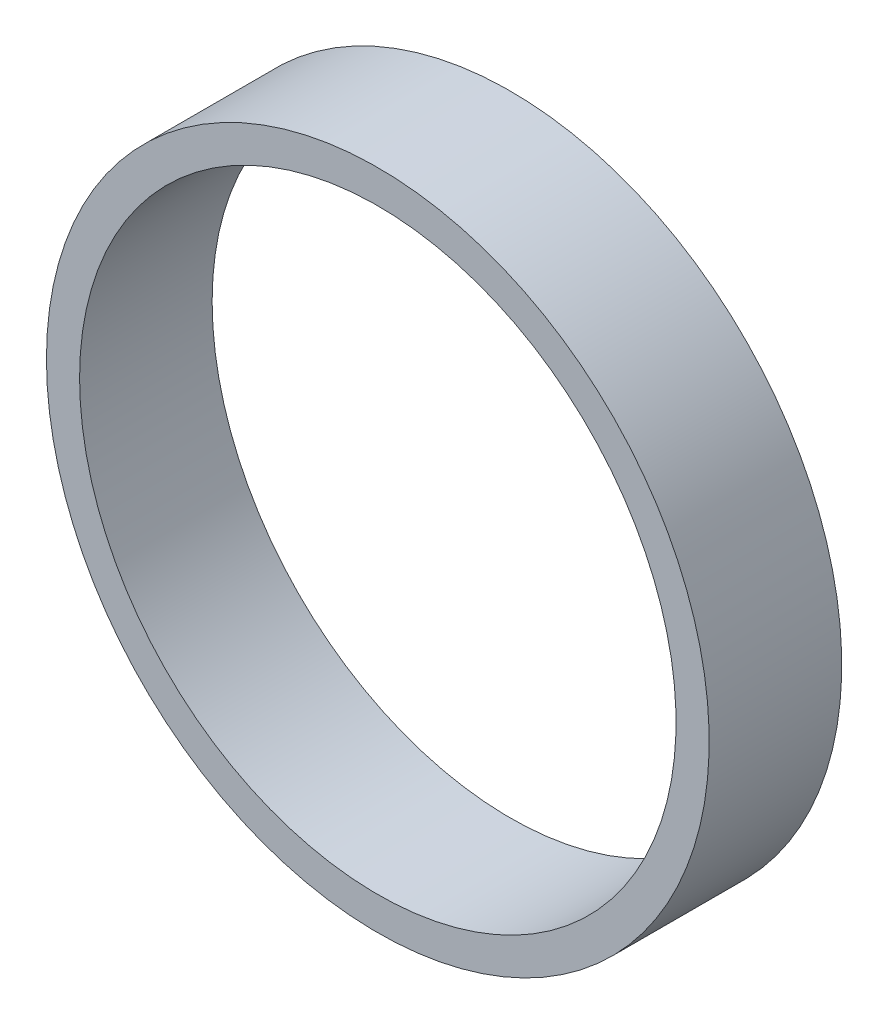
from build123d import *

# Parameters (mm, degrees)
SKETCH1_W = 5
SKETCH1_H = 20


with BuildPart() as part:
    # Sketch1 → Revolve2 (revolve)
    with BuildSketch(Plane(origin=(0, 0, 0), x_dir=(1, 0, 0), z_dir=(0, 1, 0))):
        with Locations((-47.5, 0)):
            Rectangle(SKETCH1_W, SKETCH1_H)
    revolve(axis=Axis((0, 0, -132.376712776), (0, 0, 1)))


solid = part.part
